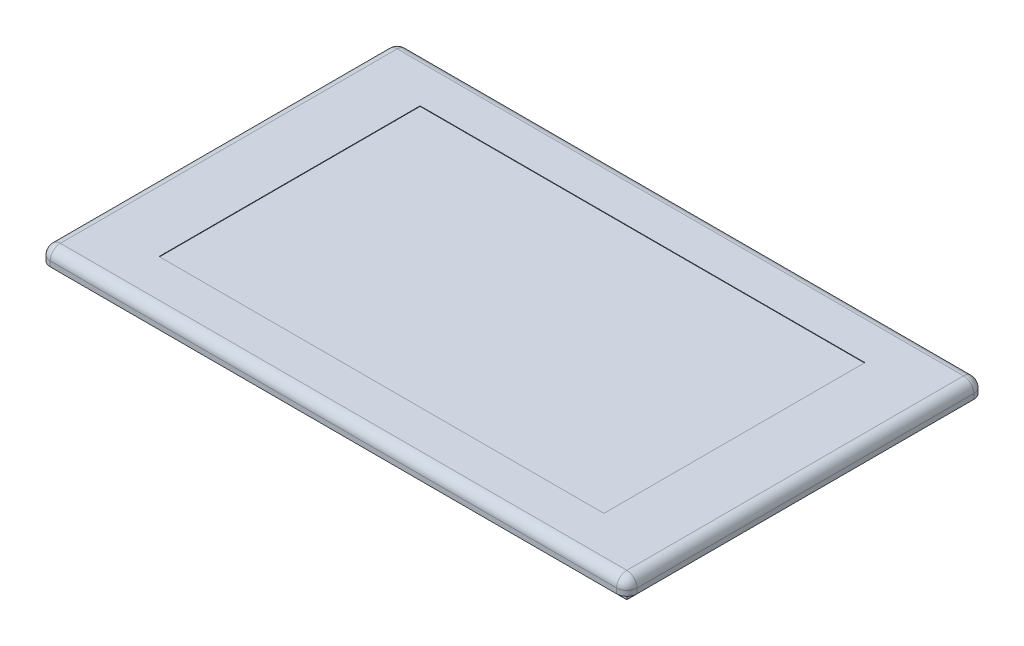
from build123d import *

# Parameters (mm, degrees)
SKETCH1_W           = 115
SKETCH1_H           = 70
BOSS_EXTRUDE1_DEPTH = 3
SKETCH2_W           = 109
SKETCH2_H           = 64
BOSS_EXTRUDE2_DEPTH = 3
FILLET1_R           = 2
SKETCH4_W           = 87.172440104
SKETCH4_H           = 51.155574538
CUT_EXTRUDE1_DEPTH  = 0.1


with BuildPart() as part:
    # Sketch1 → Boss-Extrude1 (new body)
    with BuildSketch(Plane(origin=(0, 0, 0), x_dir=(1, 0, 0), z_dir=(0, 1, 0))):
        Rectangle(SKETCH1_W, SKETCH1_H)
    extrude(amount=BOSS_EXTRUDE1_DEPTH)

    # Sketch2 → Boss-Extrude2 (add)
    with BuildSketch(Plane.XZ):
        Rectangle(SKETCH2_W, SKETCH2_H)
    extrude(amount=BOSS_EXTRUDE2_DEPTH)

    # Fillet1
    fillet1_edges = [part.edges().sort_by_distance(p)[0] for p in [
        (-57.5, 3, 0),
        (0, 3, 35),
        (57.5, 3, 0),
        (0, 3, -35),
        (57.5, 1.5, 35),
        (-57.5, 1.5, 35),
        (-57.5, 1.5, -35),
        (57.5, 1.5, -35),
    ]]
    fillet(fillet1_edges, radius=FILLET1_R)

    # Sketch4 → Cut-Extrude1 (cut)
    with BuildSketch(Plane(origin=(0, 3, 0), x_dir=(1, 0, 0), z_dir=(0, 1, 0))):
        Rectangle(SKETCH4_W, SKETCH4_H)
    extrude(amount=-CUT_EXTRUDE1_DEPTH, mode=Mode.SUBTRACT)


solid = part.part
